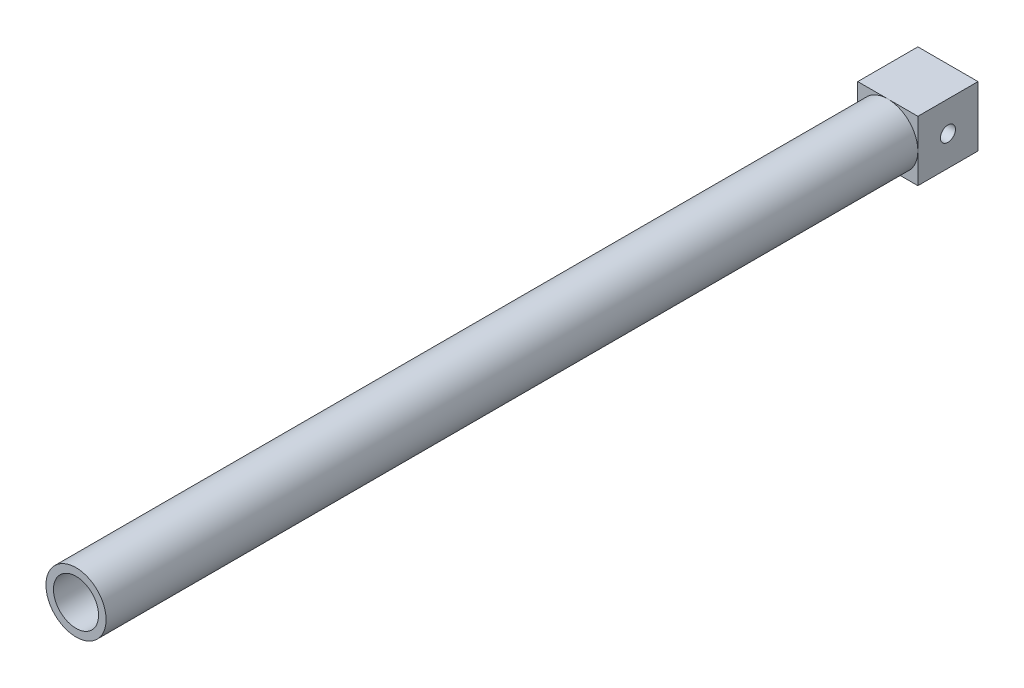
from build123d import *

# Parameters (mm, degrees)
RESSALTO_EXTRUS_O1_DEPTH      = 280
RESSALTO_EXTRUS_O1_DEPTH_BACK = 10
ESBO_O1_R                     = 10
ESBO_O2_R                     = 7.5
CORTE_EXTRUS_O1_DEPTH         = 280
RESSALTO_EXTRUS_O2_DEPTH      = 10
RESSALTO_EXTRUS_O2_DEPTH_BACK = 10
ESBO_O4_W                     = 20
ESBO_O4_H                     = 20
CORTE_EXTRUS_O2_DEPTH         = 10
CORTE_EXTRUS_O2_DEPTH_BACK    = 10
ESBO_O3_R                     = 2.5


with BuildPart() as part:
    # Esboço1 → Ressalto-extrusão1 (new, two sides: drawn at the far end of the back side and taken through both)
    with BuildSketch(Plane.XY.offset(-RESSALTO_EXTRUS_O1_DEPTH_BACK)):
        Circle(ESBO_O1_R)
    extrude(amount=RESSALTO_EXTRUS_O1_DEPTH + RESSALTO_EXTRUS_O1_DEPTH_BACK)

    # Esboço2 → Corte-extrusão1 (cut)
    with BuildSketch(Plane.XY):
        Circle(ESBO_O2_R)
    extrude(amount=CORTE_EXTRUS_O1_DEPTH, mode=Mode.SUBTRACT)

    # Esboço4 → Ressalto-extrusão2 (add, two sides: drawn at the far end of the back side and taken through both)
    with BuildSketch(Plane.XY.offset(-RESSALTO_EXTRUS_O2_DEPTH_BACK)):
        Rectangle(ESBO_O4_W, ESBO_O4_H)
    extrude(amount=RESSALTO_EXTRUS_O2_DEPTH + RESSALTO_EXTRUS_O2_DEPTH_BACK)

    # Esboço3 → Corte-extrusão2 (cut, two sides: drawn at the far end of the back side and taken through both)
    with BuildSketch(Plane(origin=(0, 0, 0), x_dir=(0, 0, -1), z_dir=(1, 0, 0)).offset(-CORTE_EXTRUS_O2_DEPTH_BACK)):
        Circle(ESBO_O3_R)
    extrude(amount=CORTE_EXTRUS_O2_DEPTH + CORTE_EXTRUS_O2_DEPTH_BACK, mode=Mode.SUBTRACT)


solid = part.part
